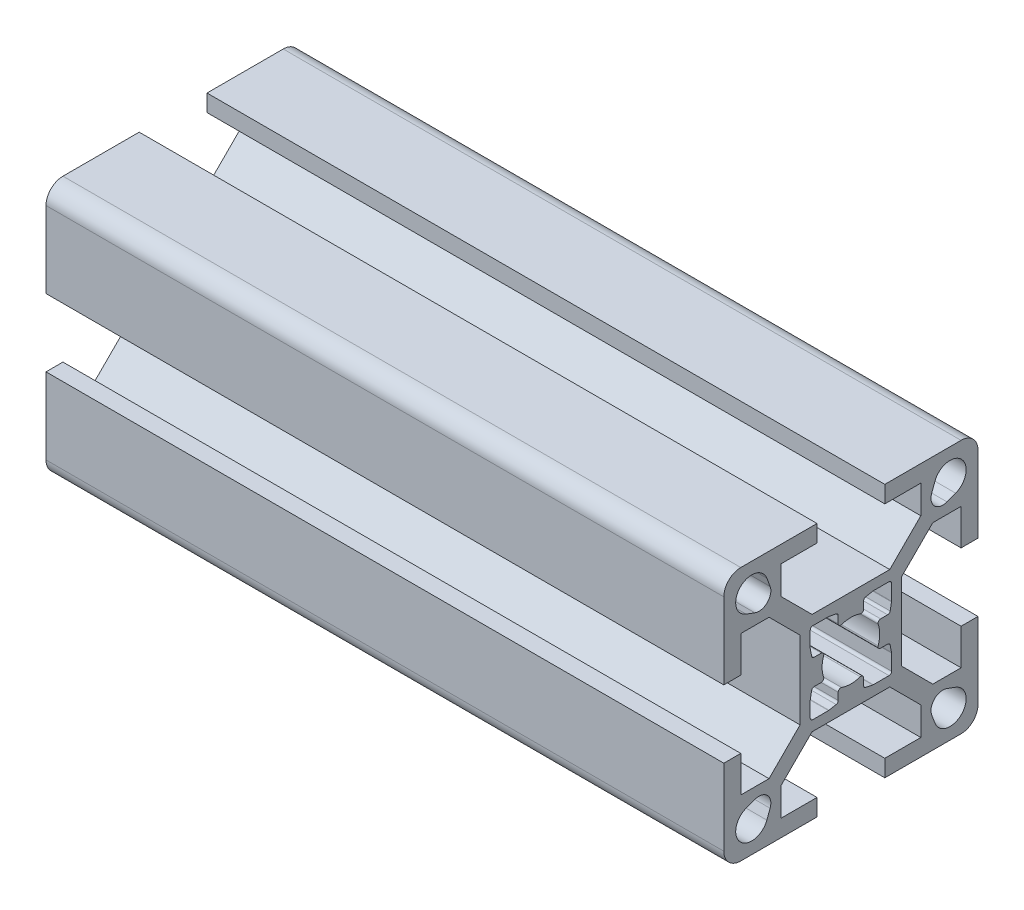
from build123d import *

# Parameters (mm, degrees)
BOSS_EXTRUDE1_DEPTH = 80


with BuildPart() as part:
    # Sketch1 → Boss-Extrude1 (new body)
    with BuildSketch(Plane(origin=(0, 0, 0), x_dir=(0, 0, -1), z_dir=(1, 0, 0))):
        with BuildLine():
            Line((-15, 13), (-15, 4))
            Line((-15, 4), (-13, 4))
            Line((-13, 4), (-13, 8.25))
            Line((-13, 8.25), (-9.664213562, 8.25))
            Line((-9.664213562, 8.25), (-6, 4.585786438))
            Line((-6, 4.585786438), (-6, -4.585786438))
            Line((-6, -4.585786438), (-9.664213562, -8.25))
            Line((-9.664213562, -8.25), (-13, -8.25))
            Line((-13, -8.25), (-13, -4))
            Line((-13, -4), (-15, -4))
            Line((-15, -4), (-15, -13))
            ThreePointArc((-15, -13), (-14.414213562, -14.414213562), (-13, -15))
            Line((-13, -15), (-4, -15))
            Line((-4, -15), (-4, -13))
            Line((-4, -13), (-8.25, -13))
            Line((-8.25, -13), (-8.25, -9.664213562))
            Line((-8.25, -9.664213562), (-4.585786438, -6))
            Line((-4.585786438, -6), (4.585786438, -6))
            Line((4.585786438, -6), (8.25, -9.664213562))
            Line((8.25, -9.664213562), (8.25, -13))
            Line((8.25, -13), (4, -13))
            Line((4, -13), (4, -15))
            Line((4, -15), (13, -15))
            ThreePointArc((13, -15), (14.414213562, -14.414213562), (15, -13))
            Line((15, -13), (15, -4))
            Line((15, -4), (13, -4))
            Line((13, -4), (13, -8.25))
            Line((13, -8.25), (9.664213562, -8.25))
            Line((9.664213562, -8.25), (6, -4.585786438))
            Line((6, -4.585786438), (6, 4.585786438))
            Line((6, 4.585786438), (9.664213562, 8.25))
            Line((9.664213562, 8.25), (13, 8.25))
            Line((13, 8.25), (13, 4))
            Line((13, 4), (15, 4))
            Line((15, 4), (15, 13))
            ThreePointArc((15, 13), (14.414213562, 14.414213562), (13, 15))
            Line((13, 15), (4, 15))
            Line((4, 15), (4, 13))
            Line((4, 13), (8.25, 13))
            Line((8.25, 13), (8.25, 9.664213562))
            Line((8.25, 9.664213562), (4.585786438, 6))
            Line((4.585786438, 6), (-4.585786438, 6))
            Line((-4.585786438, 6), (-8.25, 9.664213562))
            Line((-8.25, 9.664213562), (-8.25, 13))
            Line((-8.25, 13), (-4, 13))
            Line((-4, 13), (-4, 15))
            Line((-4, 15), (-13, 15))
            ThreePointArc((-13, 15), (-14.414213562, 14.414213562), (-15, 13))
        make_face()
        with BuildLine():
            Line((-9.539070071, 11.338915743), (-9.918883282, 12.361530981))
            ThreePointArc((-9.918883282, 12.361530981), (-13.043502884, 13.043502884), (-12.361530981, 9.918883282))
            Line((-12.361530981, 9.918883282), (-11.338915743, 9.539070071))
            ThreePointArc((-11.338915743, 9.539070071), (-9.861522369, 9.861522369), (-9.539070071, 11.338915743))
        make_face(mode=Mode.SUBTRACT)
        with BuildLine():
            Line((9.918883282, 12.361530981), (9.539070071, 11.338915743))
            ThreePointArc((9.539070071, 11.338915743), (9.861522369, 9.861522369), (11.338915743, 9.539070071))
            Line((11.338915743, 9.539070071), (12.361530981, 9.918883282))
            ThreePointArc((12.361530981, 9.918883282), (13.043502884, 13.043502884), (9.918883282, 12.361530981))
        make_face(mode=Mode.SUBTRACT)
        with BuildLine():
            Line((12.361530981, -9.918883282), (11.338915743, -9.539070071))
            ThreePointArc((11.338915743, -9.539070071), (9.861522369, -9.861522369), (9.539070071, -11.338915743))
            Line((9.539070071, -11.338915743), (9.918883282, -12.361530981))
            ThreePointArc((9.918883282, -12.361530981), (13.043502884, -13.043502884), (12.361530981, -9.918883282))
        make_face(mode=Mode.SUBTRACT)
        with BuildLine():
            Line((-11.338915743, -9.539070071), (-12.361530981, -9.918883282))
            ThreePointArc((-12.361530981, -9.918883282), (-13.043502884, -13.043502884), (-9.918883282, -12.361530981))
            Line((-9.918883282, -12.361530981), (-9.539070071, -11.338915743))
            ThreePointArc((-9.539070071, -11.338915743), (-9.861522369, -9.861522369), (-11.338915743, -9.539070071))
        make_face(mode=Mode.SUBTRACT)
        with BuildLine():
            Line((-4.8, -2.644433572), (-4.8, -4.5))
            ThreePointArc((-4.8, -4.5), (-4.712132034, -4.712132034), (-4.5, -4.8))
            Line((-4.5, -4.8), (-2.644433572, -4.8))
            ThreePointArc((-2.644433572, -4.8), (-2.615679847, -4.79861886), (-2.587190874, -4.794488155))
            Line((-2.587190874, -4.794488155), (-1.742757301, -4.630346896))
            ThreePointArc((-1.742757301, -4.630346896), (-1.568512625, -4.526682207), (-1.5, -4.335858741))
            Line((-1.5, -4.335858741), (-1.5, -3.5))
            ThreePointArc((-1.5, -3.5), (-1.374371458, -3.255879959), (-1.102702703, -3.216216216))
            ThreePointArc((-1.102702703, -3.216216216), (0, -3.4), (1.102702703, -3.216216216))
            ThreePointArc((1.102702703, -3.216216216), (1.374371458, -3.255879959), (1.5, -3.5))
            Line((1.5, -3.5), (1.5, -4.335858741))
            ThreePointArc((1.5, -4.335858741), (1.568512625, -4.526682207), (1.742757301, -4.630346896))
            Line((1.742757301, -4.630346896), (2.587190874, -4.794488155))
            ThreePointArc((2.587190874, -4.794488155), (2.615679847, -4.79861886), (2.644433572, -4.8))
            Line((2.644433572, -4.8), (4.5, -4.8))
            ThreePointArc((4.5, -4.8), (4.712132034, -4.712132034), (4.8, -4.5))
            Line((4.8, -4.5), (4.8, -2.644433572))
            ThreePointArc((4.8, -2.644433572), (4.79861886, -2.615679847), (4.794488155, -2.587190874))
            Line((4.794488155, -2.587190874), (4.630346896, -1.742757301))
            ThreePointArc((4.630346896, -1.742757301), (4.526682207, -1.568512625), (4.335858741, -1.5))
            Line((4.335858741, -1.5), (3.5, -1.5))
            ThreePointArc((3.5, -1.5), (3.255879959, -1.374371458), (3.216216216, -1.102702703))
            ThreePointArc((3.216216216, -1.102702703), (3.4, 0), (3.216216216, 1.102702703))
            ThreePointArc((3.216216216, 1.102702703), (3.255879959, 1.374371458), (3.5, 1.5))
            Line((3.5, 1.5), (4.335858741, 1.5))
            ThreePointArc((4.335858741, 1.5), (4.526682207, 1.568512625), (4.630346896, 1.742757301))
            Line((4.630346896, 1.742757301), (4.794488155, 2.587190874))
            ThreePointArc((4.794488155, 2.587190874), (4.79861886, 2.615679847), (4.8, 2.644433572))
            Line((4.8, 2.644433572), (4.8, 4.5))
            ThreePointArc((4.8, 4.5), (4.712132034, 4.712132034), (4.5, 4.8))
            Line((4.5, 4.8), (2.644433572, 4.8))
            ThreePointArc((2.644433572, 4.8), (2.615679847, 4.79861886), (2.587190874, 4.794488155))
            Line((2.587190874, 4.794488155), (1.742757301, 4.630346896))
            ThreePointArc((1.742757301, 4.630346896), (1.568512625, 4.526682207), (1.5, 4.335858741))
            Line((1.5, 4.335858741), (1.5, 3.5))
            ThreePointArc((1.5, 3.5), (1.374371458, 3.255879959), (1.102702703, 3.216216216))
            ThreePointArc((1.102702703, 3.216216216), (0, 3.4), (-1.102702703, 3.216216216))
            ThreePointArc((-1.102702703, 3.216216216), (-1.374371458, 3.255879959), (-1.5, 3.5))
            Line((-1.5, 3.5), (-1.5, 4.335858741))
            ThreePointArc((-1.5, 4.335858741), (-1.568512625, 4.526682207), (-1.742757301, 4.630346896))
            Line((-1.742757301, 4.630346896), (-2.587190874, 4.794488155))
            ThreePointArc((-2.587190874, 4.794488155), (-2.615679847, 4.79861886), (-2.644433572, 4.8))
            Line((-2.644433572, 4.8), (-4.5, 4.8))
            ThreePointArc((-4.5, 4.8), (-4.712132034, 4.712132034), (-4.8, 4.5))
            Line((-4.8, 4.5), (-4.8, 2.644433572))
            ThreePointArc((-4.8, 2.644433572), (-4.79861886, 2.615679847), (-4.794488155, 2.587190874))
            Line((-4.794488155, 2.587190874), (-4.630346896, 1.742757301))
            ThreePointArc((-4.630346896, 1.742757301), (-4.526682207, 1.568512625), (-4.335858741, 1.5))
            Line((-4.335858741, 1.5), (-3.5, 1.5))
            ThreePointArc((-3.5, 1.5), (-3.255879959, 1.374371458), (-3.216216216, 1.102702703))
            ThreePointArc((-3.216216216, 1.102702703), (-3.4, 0), (-3.216216216, -1.102702703))
            ThreePointArc((-3.216216216, -1.102702703), (-3.255879959, -1.374371458), (-3.5, -1.5))
            Line((-3.5, -1.5), (-4.335858741, -1.5))
            ThreePointArc((-4.335858741, -1.5), (-4.526682207, -1.568512625), (-4.630346896, -1.742757301))
            Line((-4.630346896, -1.742757301), (-4.794488155, -2.587190874))
            ThreePointArc((-4.794488155, -2.587190874), (-4.79861886, -2.615679847), (-4.8, -2.644433572))
        make_face(mode=Mode.SUBTRACT)
    extrude(amount=BOSS_EXTRUDE1_DEPTH)


solid = part.part
